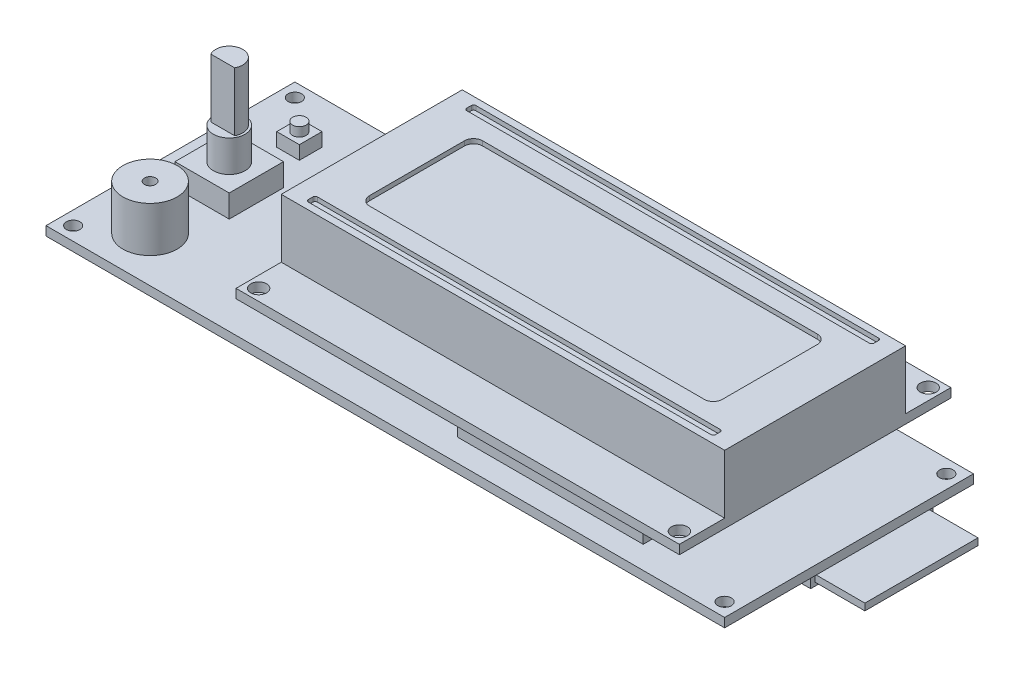
from build123d import *

# Parameters (mm, degrees)
SKETCH1_W           = 150
SKETCH1_H           = 55
SKETCH1_R           = 1.5
BOSS_EXTRUDE1_DEPTH = 2
SKETCH2_R           = 6
BOSS_EXTRUDE2_DEPTH = 10
SKETCH3_W           = 12
SKETCH3_H           = 12
BOSS_EXTRUDE3_DEPTH = 25
SKETCH4_W           = 5
SKETCH4_H           = 5
SKETCH4_W_2         = 41
SKETCH4_H_2         = 3
BOSS_EXTRUDE4_DEPTH = 5
SKETCH5_W           = 41
SKETCH5_H           = 3
SKETCH5_W_2         = 5
SKETCH5_H_2         = 5
SKETCH5_R           = 1.5
CUT_EXTRUDE1_DEPTH  = 2
SKETCH6_W           = 12
SKETCH6_H           = 12
CUT_EXTRUDE2_DEPTH  = 13
SKETCH7_W           = 12
SKETCH7_H           = 12
SKETCH7_R           = 3.5
CUT_EXTRUDE3_DEPTH  = 7
SKETCH8_R           = 1.25
CUT_EXTRUDE4_DEPTH  = 5
BOSS_EXTRUDE5_DEPTH = 3
SKETCH10_W          = 25
SKETCH10_H          = 1.5
CUT_EXTRUDE5_DEPTH  = 18
SKETCH11_W          = 98
SKETCH11_H          = 60
SKETCH11_R          = 1.75
BOSS_EXTRUDE6_DEPTH = 2
SKETCH12_W          = 98
SKETCH12_H          = 40
BOSS_EXTRUDE7_DEPTH = 13
CUT_EXTRUDE6_DEPTH  = 1
SKETCH14_W          = 25
SKETCH14_H          = 1.5
BOSS_EXTRUDE8_DEPTH = 29


with BuildPart() as part:
    # Sketch1 → Boss-Extrude1 (new body)
    with BuildSketch(Plane(origin=(0, 0, 0), x_dir=(1, 0, 0), z_dir=(0, 1, 0))):
        with Locations((75, 27.5)):
            Rectangle(SKETCH1_W, SKETCH1_H)
        with Locations(Location((3, 52, 0), (0, 0, 270))):
            Circle(SKETCH1_R, mode=Mode.SUBTRACT)
        with Locations(Location((147, 52, 0), (0, 0, 90))):
            Circle(SKETCH1_R, mode=Mode.SUBTRACT)
        with Locations(Location((147, 3, 0), (0, 0, 270))):
            Circle(SKETCH1_R, mode=Mode.SUBTRACT)
        with Locations(Location((3, 3, 0), (0, 0, 90))):
            Circle(SKETCH1_R, mode=Mode.SUBTRACT)
    extrude(amount=BOSS_EXTRUDE1_DEPTH)

    # Sketch2 → Boss-Extrude2 (add)
    with BuildSketch(Plane(origin=(0, 2, 0), x_dir=(1, 0, 0), z_dir=(0, 1, 0))):
        with Locations(Location((13, 10, 0), (0, 0, 90))):
            Circle(SKETCH2_R)
    extrude(amount=BOSS_EXTRUDE2_DEPTH)

    # Sketch3 → Boss-Extrude3 (add)
    with BuildSketch(Plane(origin=(0, 2, 0), x_dir=(1, 0, 0), z_dir=(0, 1, 0))):
        with Locations((13, 27.5)):
            Rectangle(SKETCH3_W, SKETCH3_H)
    extrude(amount=BOSS_EXTRUDE3_DEPTH)

    # Sketch4 → Boss-Extrude4 (add)
    with BuildSketch(Plane(origin=(0, 2, 0), x_dir=(1, 0, 0), z_dir=(0, 1, 0))):
        with Locations((13, 43)):
            Rectangle(SKETCH4_W, SKETCH4_H)
        with Locations((106.5, 6.5)):
            Rectangle(SKETCH4_W_2, SKETCH4_H_2)
    extrude(amount=BOSS_EXTRUDE4_DEPTH)

    # Sketch5 → Cut-Extrude1 (cut)
    # profile 1 of 2: a face of its own
    with BuildSketch(Plane(origin=(0, 7, 0), x_dir=(1, 0, 0), z_dir=(0, 1, 0))):
        with Locations((106.5, 6.5)):
            Rectangle(SKETCH5_W, SKETCH5_H)
    # profile 2 of 2: a face of its own
    with BuildSketch(Plane(origin=(0, 7, 0), x_dir=(1, 0, 0), z_dir=(0, 1, 0))):
        with Locations((13, 43)):
            Rectangle(SKETCH5_W_2, SKETCH5_H_2)
        with Locations(Location((13, 43, 0), (0, 0, 270))):
            Circle(SKETCH5_R, mode=Mode.SUBTRACT)
    extrude(amount=-CUT_EXTRUDE1_DEPTH, mode=Mode.SUBTRACT)

    # Sketch6 → Cut-Extrude2 (cut)
    with BuildSketch(Plane(origin=(0, 27, 0), x_dir=(1, 0, 0), z_dir=(0, 1, 0))):
        with Locations((13, 27.5)):
            Rectangle(SKETCH6_W, SKETCH6_H)
        with BuildLine():
            Line((10.370614338, 26.055586264), (15.629385662, 26.055586264))
            ThreePointArc((15.629385662, 26.055586264), (13, 30.5), (10.370614338, 26.055586264))
        make_face(mode=Mode.SUBTRACT)
    extrude(amount=-CUT_EXTRUDE2_DEPTH, mode=Mode.SUBTRACT)

    # Sketch7 → Cut-Extrude3 (cut)
    with BuildSketch(Plane(origin=(0, 14, 0), x_dir=(1, 0, 0), z_dir=(0, 1, 0))):
        with Locations((13, 27.5)):
            Rectangle(SKETCH7_W, SKETCH7_H)
        with Locations(Location((13, 27.5, 0), (0, 0, 270))):
            Circle(SKETCH7_R, mode=Mode.SUBTRACT)
    extrude(amount=-CUT_EXTRUDE3_DEPTH, mode=Mode.SUBTRACT)

    # Sketch8 → Cut-Extrude4 (cut)
    with BuildSketch(Plane(origin=(0, 12, 0), x_dir=(1, 0, 0), z_dir=(0, 1, 0))):
        with Locations(Location((13, 10, 0), (0, 0, 270))):
            Circle(SKETCH8_R)
    extrude(amount=-CUT_EXTRUDE4_DEPTH, mode=Mode.SUBTRACT)

    # Sketch9 → Boss-Extrude5 (add)
    with BuildSketch(Plane.XZ):
        Polygon((149, -20), (131, -20), (129, -22), (124, -22), (124, -47), (149, -47), align=None)
    extrude(amount=BOSS_EXTRUDE5_DEPTH)

    # Sketch10 → Cut-Extrude5 (cut)
    with BuildSketch(Plane(origin=(149, 0, 0), x_dir=(0, 0, -1), z_dir=(1, 0, 0))):
        with Locations((33.5, -1.5)):
            Rectangle(SKETCH10_W, SKETCH10_H)
    extrude(amount=-CUT_EXTRUDE5_DEPTH, mode=Mode.SUBTRACT)

    # Sketch11 → Boss-Extrude6 (add)
    with BuildSketch(Plane(origin=(0, 5, 0), x_dir=(1, 0, 0), z_dir=(0, 1, 0))):
        with Locations((87, 34)):
            Rectangle(SKETCH11_W, SKETCH11_H)
        with Locations(Location((40.5, 61.5, 0), (0, 0, 270))):
            Circle(SKETCH11_R, mode=Mode.SUBTRACT)
        with Locations(Location((133.5, 61.5, 0), (0, 0, 90))):
            Circle(SKETCH11_R, mode=Mode.SUBTRACT)
        with Locations(Location((133.5, 6.5, 0), (0, 0, 270))):
            Circle(SKETCH11_R, mode=Mode.SUBTRACT)
        with Locations(Location((40.5, 6.5, 0), (0, 0, 90))):
            Circle(SKETCH11_R, mode=Mode.SUBTRACT)
    extrude(amount=BOSS_EXTRUDE6_DEPTH)

    # Sketch12 → Boss-Extrude7 (add)
    with BuildSketch(Plane(origin=(0, 7, 0), x_dir=(1, 0, 0), z_dir=(0, 1, 0))):
        with Locations((87, 34)):
            Rectangle(SKETCH12_W, SKETCH12_H)
    extrude(amount=BOSS_EXTRUDE7_DEPTH)

    # Sketch13 → Cut-Extrude6 (cut)
    with BuildSketch(Plane(origin=(0, 20, 0), x_dir=(1, 0, 0), z_dir=(0, 1, 0))):
        with BuildLine():
            Line((50, 46.5), (124, 46.5))
            ThreePointArc((124, 46.5), (125.414213562, 45.914213562), (126, 44.5))
            Line((126, 44.5), (126, 23.5))
            ThreePointArc((126, 23.5), (125.414213562, 22.085786438), (124, 21.5))
            Line((124, 21.5), (50, 21.5))
            ThreePointArc((50, 21.5), (48.585786438, 22.085786438), (48, 23.5))
            Line((48, 23.5), (48, 44.5))
            ThreePointArc((48, 44.5), (48.585786438, 45.914213562), (50, 46.5))
        make_face()
        with BuildLine():
            Line((42.5, 52.5), (131.5, 52.5))
            ThreePointArc((131.5, 52.5), (131.853553391, 52.353553391), (132, 52))
            Line((132, 52), (132, 51))
            ThreePointArc((132, 51), (131.853553391, 50.646446609), (131.5, 50.5))
            Line((131.5, 50.5), (42.5, 50.5))
            ThreePointArc((42.5, 50.5), (42.146446609, 50.646446609), (42, 51))
            Line((42, 51), (42, 52))
            ThreePointArc((42, 52), (42.146446609, 52.353553391), (42.5, 52.5))
        make_face()
        with BuildLine():
            Line((132, 16), (132, 17))
            ThreePointArc((132, 17), (131.853553391, 17.353553391), (131.5, 17.5))
            Line((131.5, 17.5), (42.5, 17.5))
            ThreePointArc((42.5, 17.5), (42.146446609, 17.353553391), (42, 17))
            Line((42, 17), (42, 16))
            ThreePointArc((42, 16), (42.146446609, 15.646446609), (42.5, 15.5))
            Line((42.5, 15.5), (131.5, 15.5))
            ThreePointArc((131.5, 15.5), (131.853553391, 15.646446609), (132, 16))
        make_face()
    extrude(amount=-CUT_EXTRUDE6_DEPTH, mode=Mode.SUBTRACT)

    # Sketch14 → Boss-Extrude8 (add)
    with BuildSketch(Plane(origin=(131, 0, 0), x_dir=(0, 0, -1), z_dir=(1, 0, 0))):
        with Locations((33.5, -1.5)):
            Rectangle(SKETCH14_W, SKETCH14_H)
    extrude(amount=BOSS_EXTRUDE8_DEPTH)


solid = part.part
